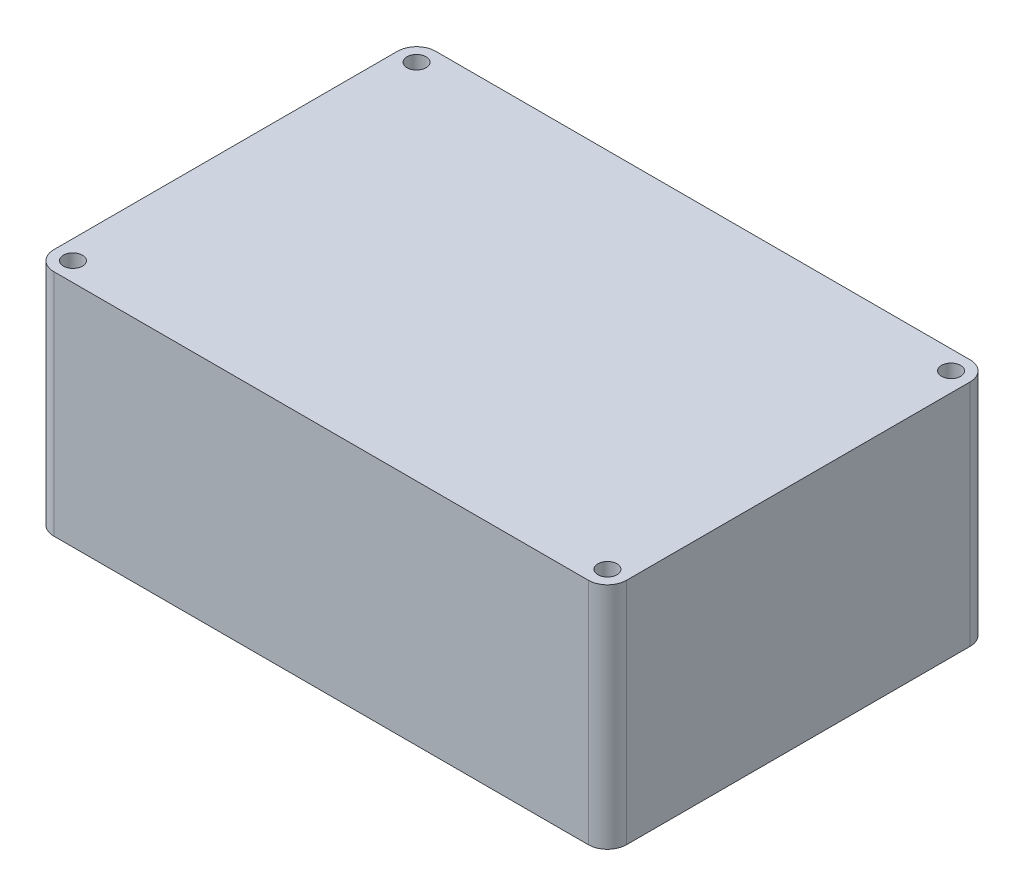
from build123d import *

# Parameters (mm, degrees)
CROQUIS1_W                                 = 300
CROQUIS1_H                                 = 200
SALIENTE_EXTRUIR1_DEPTH                    = 120
REDONDEO1_R                                = 10
CROQUIS2_R                                 = 5
CORTAR_EXTRUIR1_DEPTH                      = 217.564078277
SIMETR_A1_AT_THE_SECOND_PLANE_COPY_1_SKE_R = 5
SIMETR_A1_AT_THE_SECOND_PLANE_COPY_1_DEPTH = 217.564078277


with BuildPart() as part:
    # Croquis1 → Saliente-Extruir1 (new body)
    with BuildSketch(Plane(origin=(0, 0, 0), x_dir=(1, 0, 0), z_dir=(0, 1, 0))):
        Rectangle(CROQUIS1_W, CROQUIS1_H)
    extrude(amount=SALIENTE_EXTRUIR1_DEPTH)

    # Redondeo1
    redondeo1_edges = [part.edges().sort_by_distance(p)[0] for p in [
        (-150, 60, -100),
        (150, 60, -100),
        (150, 60, 100),
        (-150, 60, 100),
    ]]
    fillet(redondeo1_edges, radius=REDONDEO1_R)

    # Croquis2 → Cortar-Extruir1 (cut, through all)
    with BuildSketch(Plane(origin=(0, 120, 0), x_dir=(1, 0, 0), z_dir=(0, 1, 0))):
        with Locations(Location((-140, 90, 0), (0, 0, 270))):
            Circle(CROQUIS2_R)
    cortar_extruir1 = extrude(amount=-CORTAR_EXTRUIR1_DEPTH, mode=Mode.SUBTRACT)

    # Simetría1: Cortar-Extruir1 across plane
    add(cortar_extruir1.mirror(Plane.XY), mode=Mode.SUBTRACT)

    # Simetría1 at the second plane: Cortar-Extruir1 across plane
    add(cortar_extruir1.mirror(Plane(origin=(0, 0, 0), x_dir=(0, 0, 1), z_dir=(1, 0, 0))), mode=Mode.SUBTRACT)

    # Simetría1 at the second plane copy 1 ske → Simetría1 at the second plane copy 1 (cut, through all)
    with BuildSketch(Plane(origin=(0, 120, 0), x_dir=(-1, 0, 0), z_dir=(0, 1, 0))):
        with Locations(Location((-140, 90, 0), (0, 0, 270))):
            Circle(SIMETR_A1_AT_THE_SECOND_PLANE_COPY_1_SKE_R)
    extrude(amount=-SIMETR_A1_AT_THE_SECOND_PLANE_COPY_1_DEPTH, mode=Mode.SUBTRACT)


solid = part.part
